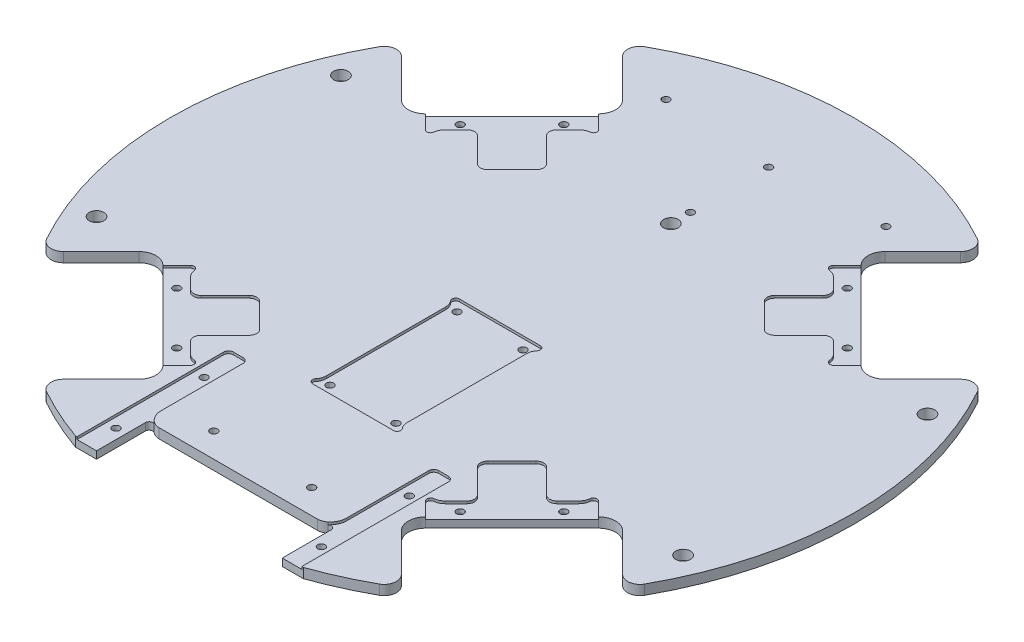
from build123d import *

# Parameters (mm, degrees)
SKETCH1_R                = 140
BOSS_EXTRUDE1_DEPTH      = 4
CUT_EXTRUDE4_REACH       = 200.03
CUT_EXTRUDE5_DEPTH       = 1
CUT_EXTRUDE10_DEPTH      = 1
CUT_EXTRUDE6_REACH       = 200.013
SKETCH9_R                = 1.5
FILLET1_R                = 5
CIRPATTERN1_COUNT        = 4
FILLET1_OF_CIRPATTERN1_R = 5
CUT_EXTRUDE1_REACH       = 200.03
CUT_EXTRUDE2_DEPTH       = 1
CUT_EXTRUDE14_DEPTH      = 1
FILLET3_R                = 1.5
CUT_EXTRUDE7_REACH       = 200.03
SKETCH10_R               = 1.5
CUT_EXTRUDE8_REACH       = 200.03
SKETCH11_R               = 1.5
CUT_EXTRUDE9_REACH       = 200.03
SKETCH13_R               = 1.5
CUT_EXTRUDE11_DEPTH      = 1
CUT_EXTRUDE12_REACH      = 200.03
SKETCH16_R               = 1.5
SKETCH16_R_2             = 3
CUT_EXTRUDE13_REACH      = 200.03
SKETCH17_R               = 3


with BuildPart() as part:
    # Sketch1 → Boss-Extrude1 (new body)
    with BuildSketch(Plane(origin=(0, 0, 0), x_dir=(1, 0, 0), z_dir=(0, 1, 0))):
        with Locations(Location((0, 0, 0), (0, 0, 270))):
            Circle(SKETCH1_R)
    extrude(amount=BOSS_EXTRUDE1_DEPTH)

    # Sketch7 → Cut-Extrude4 (cut, up to next)
    with BuildSketch(Plane(origin=(0, 4, 0), x_dir=(1, 0, 0), z_dir=(0, 1, 0)), mode=Mode.PRIVATE) as cut_extrude4_sk1:
        with BuildLine():
            Line((-89.130809769, -53.704760031), (-53.704760031, -89.130809769))
            ThreePointArc((-53.704760031, -89.130809769), (-51.66915216, -94.045201898), (-53.704760031, -98.959594027))
            Line((-53.704760031, -98.959594027), (-76.367532368, -121.622366364))
            Line((-76.367532368, -121.622366364), (-121.622366364, -76.367532368))
            Line((-121.622366364, -76.367532368), (-98.959594027, -53.704760031))
            ThreePointArc((-98.959594027, -53.704760031), (-94.045201898, -51.66915216), (-89.130809769, -53.704760031))
        make_face()
    cut_extrude4_tool1 = extrude(cut_extrude4_sk1.sketch, amount=-CUT_EXTRUDE4_REACH, mode=Mode.PRIVATE) & part.part
    cut_extrude4 = cut_extrude4_tool1.solids().sort_by_distance((-85.312659, 4, 85.312659))[0]
    add(cut_extrude4, mode=Mode.SUBTRACT)

    # Sketch8 → Cut-Extrude5 (cut)
    with BuildSketch(Plane(origin=(0, 4, 0), x_dir=(1, 0, 0), z_dir=(0, 1, 0))):
        with BuildLine():
            Line((-89.130809769, -53.704760031), (-53.704760031, -89.130809769))
            Line((-53.704760031, -89.130809769), (-48.047905782, -83.473955519))
            ThreePointArc((-48.047905782, -83.473955519), (-47.697756039, -81.903770682), (-48.970404675, -80.919671746))
            ThreePointArc((-48.970404675, -80.919671746), (-50.634216784, -80.467198423), (-52.045400985, -79.476460316))
            Line((-52.045400985, -79.476460316), (-79.476460316, -52.045400985))
            ThreePointArc((-79.476460316, -52.045400985), (-80.467198423, -50.634216784), (-80.919671746, -48.970404675))
            ThreePointArc((-80.919671746, -48.970404675), (-81.903770682, -47.697756039), (-83.473955519, -48.047905782))
            Line((-83.473955519, -48.047905782), (-89.130809769, -53.704760031))
        make_face()
    cut_extrude5 = extrude(amount=-CUT_EXTRUDE5_DEPTH, mode=Mode.SUBTRACT)

    # Sketch14 → Cut-Extrude10 (cut)
    with BuildSketch(Plane(origin=(0, 4, 0), x_dir=(1, 0, 0), z_dir=(0, 1, 0))):
        with BuildLine():
            Line((-70.710678119, -56.568542495), (-60.811183182, -46.669047558))
            ThreePointArc((-60.811183182, -46.669047558), (-58.689862838, -45.790367902), (-56.568542495, -46.669047558))
            Line((-56.568542495, -46.669047558), (-46.669047558, -56.568542495))
            ThreePointArc((-46.669047558, -56.568542495), (-45.790367902, -58.689862838), (-46.669047558, -60.811183182))
            Line((-46.669047558, -60.811183182), (-56.568542495, -70.710678119))
            ThreePointArc((-56.568542495, -70.710678119), (-57.447222151, -72.831998462), (-56.568542495, -74.953318806))
            Line((-56.568542495, -74.953318806), (-74.953318806, -56.568542495))
            ThreePointArc((-74.953318806, -56.568542495), (-72.831998462, -57.447222151), (-70.710678119, -56.568542495))
        make_face()
    cut_extrude10 = extrude(amount=-CUT_EXTRUDE10_DEPTH, mode=Mode.SUBTRACT)

    # Sketch9 → Cut-Extrude6 (cut, up to next)
    with BuildSketch(Plane(origin=(0, 3, 0), x_dir=(1, 0, 0), z_dir=(0, 1, 0)), mode=Mode.PRIVATE) as cut_extrude6_sk1:
        with Locations(Location((-79.195959493, -57.982756057, 0), (0, 0, 270))):
            Circle(SKETCH9_R)
    cut_extrude6_tool1 = extrude(cut_extrude6_sk1.sketch, amount=-CUT_EXTRUDE6_REACH, mode=Mode.PRIVATE) & part.part
    # Sketch9 → Cut-Extrude6 (cut, up to next)
    with BuildSketch(Plane(origin=(0, 3, 0), x_dir=(1, 0, 0), z_dir=(0, 1, 0)), mode=Mode.PRIVATE) as cut_extrude6_sk2:
        with Locations(Location((-57.982756057, -79.195959493, 0), (0, 0, 270))):
            Circle(SKETCH9_R)
    cut_extrude6_tool2 = extrude(cut_extrude6_sk2.sketch, amount=-CUT_EXTRUDE6_REACH, mode=Mode.PRIVATE) & part.part
    cut_extrude6_1 = cut_extrude6_tool1.solids().sort_by_distance((-79.195959, 3, 57.982756))[0]
    add(cut_extrude6_1, mode=Mode.SUBTRACT)
    cut_extrude6_2 = cut_extrude6_tool2.solids().sort_by_distance((-57.982756, 3, 79.195959))[0]
    add(cut_extrude6_2, mode=Mode.SUBTRACT)
    cut_extrude6 = cut_extrude6_1 + cut_extrude6_2  # Cut-Extrude6 as one shape, for the pattern or mirror that repeats it

    # Fillet1
    fillet1_edges = [part.edges().sort_by_distance(p)[0] for p in [
        (-119.001687423, 2, 73.746853427),
        (-73.746853427, 2, 119.001687423),
    ]]
    fillet(fillet1_edges, radius=FILLET1_R)

    # CirPattern1: Cut-Extrude4, Cut-Extrude5, Cut-Extrude10, Cut-Extrude6 ×4 about axis
    cirpattern1_axis = Axis((0, 0, 0), (0, 1, 0))
    add([cut_extrude4.rotate(cirpattern1_axis, i * 360 / CIRPATTERN1_COUNT) for i in range(1, CIRPATTERN1_COUNT)], mode=Mode.SUBTRACT)
    add([cut_extrude5.rotate(cirpattern1_axis, i * 360 / CIRPATTERN1_COUNT) for i in range(1, CIRPATTERN1_COUNT)], mode=Mode.SUBTRACT)
    add([cut_extrude10.rotate(cirpattern1_axis, i * 360 / CIRPATTERN1_COUNT) for i in range(1, CIRPATTERN1_COUNT)], mode=Mode.SUBTRACT)
    add([cut_extrude6.rotate(cirpattern1_axis, i * 360 / CIRPATTERN1_COUNT) for i in range(1, CIRPATTERN1_COUNT)], mode=Mode.SUBTRACT)

    # Fillet1 of CirPattern1
    fillet1_of_cirpattern1_edges = [part.edges().sort_by_distance(p)[0] for p in [
        (73.746853427, 2, 119.001687423),
        (119.001687423, 2, 73.746853427),
        (119.001687423, 2, -73.746853427),
        (73.746853427, 2, -119.001687423),
        (-73.746853427, 2, -119.001687423),
        (-119.001687423, 2, -73.746853427),
    ]]
    fillet(fillet1_of_cirpattern1_edges, radius=FILLET1_OF_CIRPATTERN1_R)

    # Sketch2 → Cut-Extrude1 (cut, up to next)
    with BuildSketch(Plane(origin=(0, 4, 0), x_dir=(1, 0, 0), z_dir=(0, 1, 0)), mode=Mode.PRIVATE) as cut_extrude1_sk1:
        with BuildLine():
            Line((-46.647615159, -132), (-38, -132))
            Line((-38, -132), (-38, -112))
            ThreePointArc((-38, -112), (-37.137304912, -110.642118396), (-35.5415434, -110.846153846))
            ThreePointArc((-35.5415434, -110.846153846), (-34.04510362, -111.702699716), (-32.346688069, -112))
            Line((-32.346688069, -112), (32.346688069, -112))
            ThreePointArc((32.346688069, -112), (34.04510362, -111.702699716), (35.5415434, -110.846153846))
            ThreePointArc((35.5415434, -110.846153846), (37.137304912, -110.642118396), (38, -112))
            Line((38, -112), (38, -132))
            Line((38, -132), (46.647615159, -132))
            Line((46.647615159, -132), (46.647615159, -140))
            Line((46.647615159, -140), (-46.647615159, -140))
            Line((-46.647615159, -140), (-46.647615159, -132))
        make_face()
    cut_extrude1_tool1 = extrude(cut_extrude1_sk1.sketch, amount=-CUT_EXTRUDE1_REACH, mode=Mode.PRIVATE) & part.part
    add(cut_extrude1_tool1.solids().sort_by_distance((0, 4, 126.553554))[0], mode=Mode.SUBTRACT)

    # Sketch3 → Cut-Extrude2 (cut)
    with BuildSketch(Plane(origin=(0, 4, 0), x_dir=(1, 0, 0), z_dir=(0, 1, 0))):
        with BuildLine():
            Line((-38, -132), (-46, -132))
            Line((-46, -132), (-46, -72))
            ThreePointArc((-46, -72), (-45.414213562, -70.585786438), (-44, -70))
            Line((-44, -70), (-40, -70))
            ThreePointArc((-40, -70), (-38.585786438, -70.585786438), (-38, -72))
            Line((-38, -72), (-38, -132))
        make_face()
        with BuildLine():
            Line((38, -132), (46, -132))
            Line((46, -132), (46, -72))
            ThreePointArc((46, -72), (45.414213562, -70.585786438), (44, -70))
            Line((44, -70), (40, -70))
            ThreePointArc((40, -70), (38.585786438, -70.585786438), (38, -72))
            Line((38, -72), (38, -132))
        make_face()
    extrude(amount=-CUT_EXTRUDE2_DEPTH, mode=Mode.SUBTRACT)

    # Sketch18 → Cut-Extrude14 (cut)
    with BuildSketch(Plane(origin=(0, 4, 0), x_dir=(1, 0, 0), z_dir=(0, 1, 0))):
        with BuildLine():
            Line((-38, -105.608012841), (-38, -112))
            Line((-38, -112), (-35.5415434, -110.846153846))
            ThreePointArc((-35.5415434, -110.846153846), (-37.354821961, -108.501200099), (-38, -105.608012841))
        make_face()
        with BuildLine():
            Line((38, -105.608012841), (38, -112))
            Line((38, -112), (35.5415434, -110.846153846))
            ThreePointArc((35.5415434, -110.846153846), (37.354821961, -108.501200099), (38, -105.608012841))
        make_face()
    extrude(amount=-CUT_EXTRUDE14_DEPTH, mode=Mode.SUBTRACT)

    # Fillet3
    fillet3_edges = [part.edges().sort_by_distance(p)[0] for p in [
        (56.482756057, 0, 79.195959493),
        (77.695959493, 0, 57.982756057),
        (79.195959493, 0, -56.482756057),
        (57.982756057, 0, -77.695959493),
        (-56.482756057, 0, -79.195959493),
        (-77.695959493, 0, -57.982756057),
        (-79.195959493, 0, 56.482756057),
        (-57.982756057, 0, 77.695959493),
    ]]
    fillet(fillet3_edges, radius=FILLET3_R)

    # Sketch10 → Cut-Extrude7 (cut, up to next)
    with BuildSketch(Plane(origin=(0, 4, 0), x_dir=(1, 0, 0), z_dir=(0, 1, 0)), mode=Mode.PRIVATE) as cut_extrude7_sk1:
        with Locations(Location((-13.5, -61, 0), (0, 0, 270))):
            Circle(SKETCH10_R)
    cut_extrude7_tool1 = extrude(cut_extrude7_sk1.sketch, amount=-CUT_EXTRUDE7_REACH, mode=Mode.PRIVATE) & part.part
    # Sketch10 → Cut-Extrude7 (cut, up to next)
    with BuildSketch(Plane(origin=(0, 4, 0), x_dir=(1, 0, 0), z_dir=(0, 1, 0)), mode=Mode.PRIVATE) as cut_extrude7_sk2:
        with Locations(Location((13.5, -61, 0), (0, 0, 270))):
            Circle(SKETCH10_R)
    cut_extrude7_tool2 = extrude(cut_extrude7_sk2.sketch, amount=-CUT_EXTRUDE7_REACH, mode=Mode.PRIVATE) & part.part
    # Sketch10 → Cut-Extrude7 (cut, up to next)
    with BuildSketch(Plane(origin=(0, 4, 0), x_dir=(1, 0, 0), z_dir=(0, 1, 0)), mode=Mode.PRIVATE) as cut_extrude7_sk3:
        with Locations(Location((-13.5, -9, 0), (0, 0, 270))):
            Circle(SKETCH10_R)
    cut_extrude7_tool3 = extrude(cut_extrude7_sk3.sketch, amount=-CUT_EXTRUDE7_REACH, mode=Mode.PRIVATE) & part.part
    # Sketch10 → Cut-Extrude7 (cut, up to next)
    with BuildSketch(Plane(origin=(0, 4, 0), x_dir=(1, 0, 0), z_dir=(0, 1, 0)), mode=Mode.PRIVATE) as cut_extrude7_sk4:
        with Locations(Location((13.5, -9, 0), (0, 0, 270))):
            Circle(SKETCH10_R)
    cut_extrude7_tool4 = extrude(cut_extrude7_sk4.sketch, amount=-CUT_EXTRUDE7_REACH, mode=Mode.PRIVATE) & part.part
    add(cut_extrude7_tool1.solids().sort_by_distance((-13.5, 4, 61))[0], mode=Mode.SUBTRACT)
    add(cut_extrude7_tool2.solids().sort_by_distance((13.5, 4, 61))[0], mode=Mode.SUBTRACT)
    add(cut_extrude7_tool3.solids().sort_by_distance((-13.5, 4, 9))[0], mode=Mode.SUBTRACT)
    add(cut_extrude7_tool4.solids().sort_by_distance((13.5, 4, 9))[0], mode=Mode.SUBTRACT)

    # Sketch11 → Cut-Extrude8 (cut, up to next)
    with BuildSketch(Plane(origin=(0, 4, 0), x_dir=(1, 0, 0), z_dir=(0, 1, 0)), mode=Mode.PRIVATE) as cut_extrude8_sk1:
        with Locations(Location((-20, -102, 0), (0, 0, 270))):
            Circle(SKETCH11_R)
    cut_extrude8_tool1 = extrude(cut_extrude8_sk1.sketch, amount=-CUT_EXTRUDE8_REACH, mode=Mode.PRIVATE) & part.part
    # Sketch11 → Cut-Extrude8 (cut, up to next)
    with BuildSketch(Plane(origin=(0, 4, 0), x_dir=(1, 0, 0), z_dir=(0, 1, 0)), mode=Mode.PRIVATE) as cut_extrude8_sk2:
        with Locations(Location((20, -102, 0), (0, 0, 270))):
            Circle(SKETCH11_R)
    cut_extrude8_tool2 = extrude(cut_extrude8_sk2.sketch, amount=-CUT_EXTRUDE8_REACH, mode=Mode.PRIVATE) & part.part
    add(cut_extrude8_tool1.solids().sort_by_distance((-20, 4, 102))[0], mode=Mode.SUBTRACT)
    add(cut_extrude8_tool2.solids().sort_by_distance((20, 4, 102))[0], mode=Mode.SUBTRACT)

    # Sketch13 → Cut-Extrude9 (cut, up to next)
    with BuildSketch(Plane(origin=(0, 4, 0), x_dir=(1, 0, 0), z_dir=(0, 1, 0)), mode=Mode.PRIVATE) as cut_extrude9_sk1:
        with Locations(Location((-42, -84, 0), (0, 0, 270))):
            Circle(SKETCH13_R)
    cut_extrude9_tool1 = extrude(cut_extrude9_sk1.sketch, amount=-CUT_EXTRUDE9_REACH, mode=Mode.PRIVATE) & part.part
    # Sketch13 → Cut-Extrude9 (cut, up to next)
    with BuildSketch(Plane(origin=(0, 4, 0), x_dir=(1, 0, 0), z_dir=(0, 1, 0)), mode=Mode.PRIVATE) as cut_extrude9_sk2:
        with Locations(Location((-42, -120, 0), (0, 0, 270))):
            Circle(SKETCH13_R)
    cut_extrude9_tool2 = extrude(cut_extrude9_sk2.sketch, amount=-CUT_EXTRUDE9_REACH, mode=Mode.PRIVATE) & part.part
    # Sketch13 → Cut-Extrude9 (cut, up to next)
    with BuildSketch(Plane(origin=(0, 4, 0), x_dir=(1, 0, 0), z_dir=(0, 1, 0)), mode=Mode.PRIVATE) as cut_extrude9_sk3:
        with Locations(Location((42, -120, 0), (0, 0, 270))):
            Circle(SKETCH13_R)
    cut_extrude9_tool3 = extrude(cut_extrude9_sk3.sketch, amount=-CUT_EXTRUDE9_REACH, mode=Mode.PRIVATE) & part.part
    # Sketch13 → Cut-Extrude9 (cut, up to next)
    with BuildSketch(Plane(origin=(0, 4, 0), x_dir=(1, 0, 0), z_dir=(0, 1, 0)), mode=Mode.PRIVATE) as cut_extrude9_sk4:
        with Locations(Location((42, -84, 0), (0, 0, 270))):
            Circle(SKETCH13_R)
    cut_extrude9_tool4 = extrude(cut_extrude9_sk4.sketch, amount=-CUT_EXTRUDE9_REACH, mode=Mode.PRIVATE) & part.part
    add(cut_extrude9_tool1.solids().sort_by_distance((-42, 4, 84))[0], mode=Mode.SUBTRACT)
    add(cut_extrude9_tool2.solids().sort_by_distance((-42, 4, 120))[0], mode=Mode.SUBTRACT)
    add(cut_extrude9_tool3.solids().sort_by_distance((42, 4, 120))[0], mode=Mode.SUBTRACT)
    add(cut_extrude9_tool4.solids().sort_by_distance((42, 4, 84))[0], mode=Mode.SUBTRACT)

    # Sketch15 → Cut-Extrude11 (cut)
    with BuildSketch(Plane(origin=(0, 4, 0), x_dir=(1, 0, 0), z_dir=(0, 1, 0))):
        with BuildLine():
            Line((-16.55, -4.95), (16.55, -4.95))
            ThreePointArc((16.55, -4.95), (17.907881604, -5.812695088), (17.703846154, -7.4084566))
            ThreePointArc((17.703846154, -7.4084566), (16.847300284, -8.90489638), (16.55, -10.603311931))
            Line((16.55, -10.603311931), (16.55, -59.396688069))
            ThreePointArc((16.55, -59.396688069), (16.847300284, -61.09510362), (17.703846154, -62.5915434))
            ThreePointArc((17.703846154, -62.5915434), (17.907881604, -64.187304912), (16.55, -65.05))
            Line((16.55, -65.05), (-16.55, -65.05))
            ThreePointArc((-16.55, -65.05), (-17.907881604, -64.187304912), (-17.703846154, -62.5915434))
            ThreePointArc((-17.703846154, -62.5915434), (-16.847300284, -61.09510362), (-16.55, -59.396688069))
            Line((-16.55, -59.396688069), (-16.55, -10.603311931))
            ThreePointArc((-16.55, -10.603311931), (-16.847300284, -8.90489638), (-17.703846154, -7.4084566))
            ThreePointArc((-17.703846154, -7.4084566), (-17.907881604, -5.812695088), (-16.55, -4.95))
        make_face()
    extrude(amount=-CUT_EXTRUDE11_DEPTH, mode=Mode.SUBTRACT)

    # Sketch16 → Cut-Extrude12 (cut, up to next)
    with BuildSketch(Plane(origin=(0, 4, 0), x_dir=(1, 0, 0), z_dir=(0, 1, 0)), mode=Mode.PRIVATE) as cut_extrude12_sk1:
        with Locations(Location((0, 73, 0), (0, 0, 270))):
            Circle(SKETCH16_R)
    cut_extrude12_tool1 = extrude(cut_extrude12_sk1.sketch, amount=-CUT_EXTRUDE12_REACH, mode=Mode.PRIVATE) & part.part
    # Sketch16 → Cut-Extrude12 (cut, up to next)
    with BuildSketch(Plane(origin=(0, 4, 0), x_dir=(1, 0, 0), z_dir=(0, 1, 0)), mode=Mode.PRIVATE) as cut_extrude12_sk2:
        with Locations(Location((-45, 108, 0), (0, 0, 270))):
            Circle(SKETCH16_R)
    cut_extrude12_tool2 = extrude(cut_extrude12_sk2.sketch, amount=-CUT_EXTRUDE12_REACH, mode=Mode.PRIVATE) & part.part
    # Sketch16 → Cut-Extrude12 (cut, up to next)
    with BuildSketch(Plane(origin=(0, 4, 0), x_dir=(1, 0, 0), z_dir=(0, 1, 0)), mode=Mode.PRIVATE) as cut_extrude12_sk3:
        with Locations(Location((45, 108, 0), (0, 0, 270))):
            Circle(SKETCH16_R)
    cut_extrude12_tool3 = extrude(cut_extrude12_sk3.sketch, amount=-CUT_EXTRUDE12_REACH, mode=Mode.PRIVATE) & part.part
    # Sketch16 → Cut-Extrude12 (cut, up to next)
    with BuildSketch(Plane(origin=(0, 4, 0), x_dir=(1, 0, 0), z_dir=(0, 1, 0)), mode=Mode.PRIVATE) as cut_extrude12_sk4:
        with Locations(Location((0, 105, 0), (0, 0, 270))):
            Circle(SKETCH16_R)
    cut_extrude12_tool4 = extrude(cut_extrude12_sk4.sketch, amount=-CUT_EXTRUDE12_REACH, mode=Mode.PRIVATE) & part.part
    # Sketch16 → Cut-Extrude12 (cut, up to next)
    with BuildSketch(Plane(origin=(0, 4, 0), x_dir=(1, 0, 0), z_dir=(0, 1, 0)), mode=Mode.PRIVATE) as cut_extrude12_sk5:
        with Locations(Location((0, 65, 0), (0, 0, 270))):
            Circle(SKETCH16_R_2)
    cut_extrude12_tool5 = extrude(cut_extrude12_sk5.sketch, amount=-CUT_EXTRUDE12_REACH, mode=Mode.PRIVATE) & part.part
    add(cut_extrude12_tool1.solids().sort_by_distance((0, 4, -73))[0], mode=Mode.SUBTRACT)
    add(cut_extrude12_tool2.solids().sort_by_distance((-45, 4, -108))[0], mode=Mode.SUBTRACT)
    add(cut_extrude12_tool3.solids().sort_by_distance((45, 4, -108))[0], mode=Mode.SUBTRACT)
    add(cut_extrude12_tool4.solids().sort_by_distance((0, 4, -105))[0], mode=Mode.SUBTRACT)
    add(cut_extrude12_tool5.solids().sort_by_distance((0, 4, -65))[0], mode=Mode.SUBTRACT)

    # Sketch17 → Cut-Extrude13 (cut, up to next)
    with BuildSketch(Plane(origin=(0, 4, 0), x_dir=(1, 0, 0), z_dir=(0, 1, 0)), mode=Mode.PRIVATE) as cut_extrude13_sk1:
        with Locations(Location((-120, 50, 0), (0, 0, 270))):
            Circle(SKETCH17_R)
    cut_extrude13_tool1 = extrude(cut_extrude13_sk1.sketch, amount=-CUT_EXTRUDE13_REACH, mode=Mode.PRIVATE) & part.part
    # Sketch17 → Cut-Extrude13 (cut, up to next)
    with BuildSketch(Plane(origin=(0, 4, 0), x_dir=(1, 0, 0), z_dir=(0, 1, 0)), mode=Mode.PRIVATE) as cut_extrude13_sk2:
        with Locations(Location((-120, -50, 0), (0, 0, 270))):
            Circle(SKETCH17_R)
    cut_extrude13_tool2 = extrude(cut_extrude13_sk2.sketch, amount=-CUT_EXTRUDE13_REACH, mode=Mode.PRIVATE) & part.part
    # Sketch17 → Cut-Extrude13 (cut, up to next)
    with BuildSketch(Plane(origin=(0, 4, 0), x_dir=(1, 0, 0), z_dir=(0, 1, 0)), mode=Mode.PRIVATE) as cut_extrude13_sk3:
        with Locations(Location((120, 50, 0), (0, 0, 270))):
            Circle(SKETCH17_R)
    cut_extrude13_tool3 = extrude(cut_extrude13_sk3.sketch, amount=-CUT_EXTRUDE13_REACH, mode=Mode.PRIVATE) & part.part
    # Sketch17 → Cut-Extrude13 (cut, up to next)
    with BuildSketch(Plane(origin=(0, 4, 0), x_dir=(1, 0, 0), z_dir=(0, 1, 0)), mode=Mode.PRIVATE) as cut_extrude13_sk4:
        with Locations(Location((120, -50, 0), (0, 0, 270))):
            Circle(SKETCH17_R)
    cut_extrude13_tool4 = extrude(cut_extrude13_sk4.sketch, amount=-CUT_EXTRUDE13_REACH, mode=Mode.PRIVATE) & part.part
    add(cut_extrude13_tool1.solids().sort_by_distance((-120, 4, -50))[0], mode=Mode.SUBTRACT)
    add(cut_extrude13_tool2.solids().sort_by_distance((-120, 4, 50))[0], mode=Mode.SUBTRACT)
    add(cut_extrude13_tool3.solids().sort_by_distance((120, 4, -50))[0], mode=Mode.SUBTRACT)
    add(cut_extrude13_tool4.solids().sort_by_distance((120, 4, 50))[0], mode=Mode.SUBTRACT)


solid = part.part
